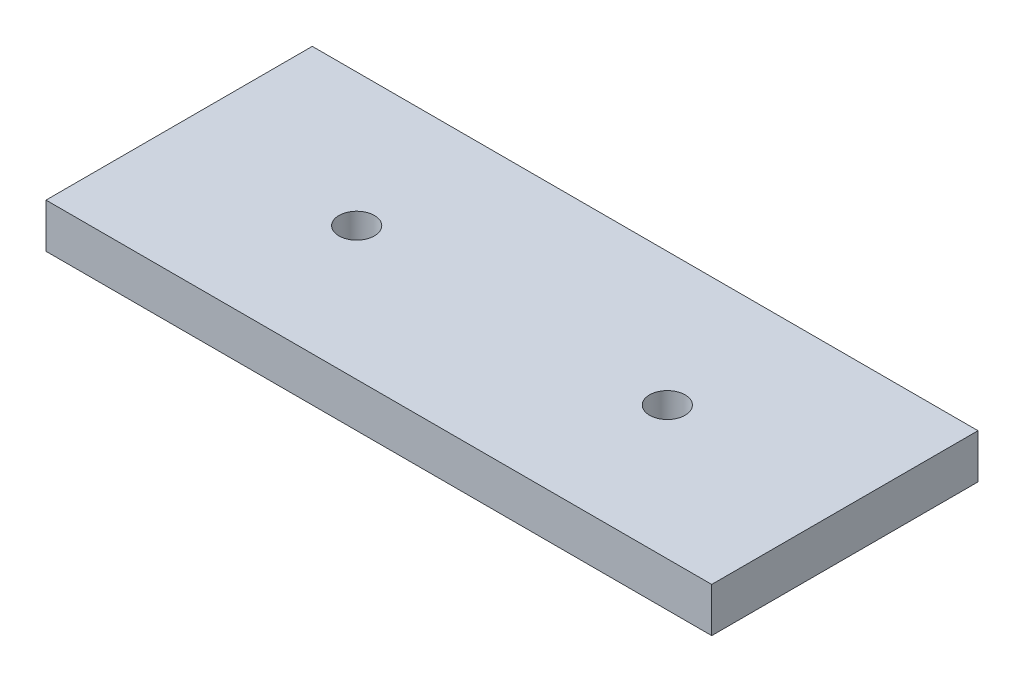
from build123d import *

# Parameters (mm, degrees)
SKETCH1_W           = 75
SKETCH1_H           = 30
SKETCH1_R           = 2
BOSS_EXTRUDE1_DEPTH = 5


with BuildPart() as part:
    # Sketch1 → Boss-Extrude1 (new body)
    with BuildSketch(Plane(origin=(0, 0, 0), x_dir=(1, 0, 0), z_dir=(0, 1, 0))):
        with Locations((37.5, -15)):
            Rectangle(SKETCH1_W, SKETCH1_H)
        with Locations(Location((20, -15, 0), (0, 0, 270))):
            Circle(SKETCH1_R, mode=Mode.SUBTRACT)
        with Locations(Location((55, -15, 0), (0, 0, 270))):
            Circle(SKETCH1_R, mode=Mode.SUBTRACT)
    extrude(amount=BOSS_EXTRUDE1_DEPTH)


solid = part.part
